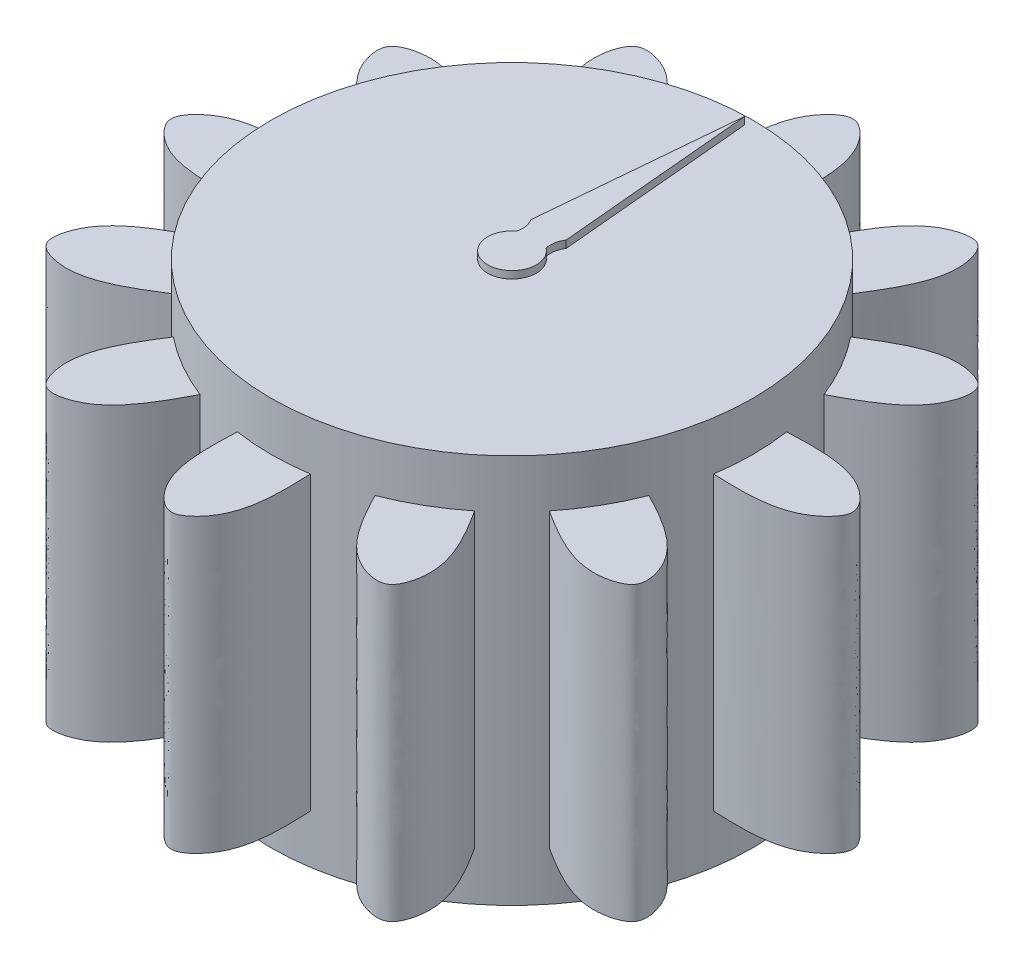
from build123d import *

# Parameters (mm, degrees)
SKETCH1_R           = 9.9
BOSS_EXTRUDE1_DEPTH = 12
SKETCH2_R           = 9.9
BOSS_EXTRUDE2_DEPTH = 2
BOSS_EXTRUDE3_DEPTH = 0.3
BOSS_EXTRUDE5_DEPTH = 12
CIRPATTERN1_COUNT   = 12
BOSS_EXTRUDE6_START = 2
SKETCH5_R           = 9.9
BOSS_EXTRUDE6_DEPTH = 2
BOSS_EXTRUDE7_START = 0.3
BOSS_EXTRUDE7_DEPTH = 0.3


with BuildPart() as part:
    # Sketch1 → Boss-Extrude1 (new body)
    with BuildSketch(Plane(origin=(0, 0, 0), x_dir=(1, 0, 0), z_dir=(0, 1, 0))):
        with Locations(Location((0, 0, 0), (0, 0, 270))):
            Circle(SKETCH1_R)
    extrude(amount=BOSS_EXTRUDE1_DEPTH)

    # Sketch2 → Boss-Extrude2 (add)
    with BuildSketch(Plane(origin=(0, 12, 0), x_dir=(1, 0, 0), z_dir=(0, 1, 0))):
        with Locations(Location((0, 0, 0), (0, 0, 270))):
            Circle(SKETCH2_R)
    extrude(amount=BOSS_EXTRUDE2_DEPTH)

    # Sketch3 → Boss-Extrude3 (add)
    with BuildSketch(Plane(origin=(0, 14, 0), x_dir=(1, 0, 0), z_dir=(0, 1, 0))):
        with BuildLine():
            Line((0, 9.561873975), (0.727858815, 1.5))
            ThreePointArc((0.727858815, 1.5), (0.597494474, 1.162134703), (0.6, 0.8))
            ThreePointArc((0.6, 0.8), (0, -1), (-0.6, 0.8))
            ThreePointArc((-0.6, 0.8), (-0.592381481, 1.161228328), (-0.71735976, 1.500233309))
            Line((-0.71735976, 1.500233309), (0, 9.561873975))
        make_face()
    extrude(amount=BOSS_EXTRUDE3_DEPTH)

    # Sketch4 → Boss-Extrude5 (add)
    with BuildSketch(Plane.XZ):
        with BuildLine():
            Line((-1.5, -9.785703858), (1.5, -9.785703858))
            add(Edge.make_bspline(
                [(1.5, -9.785703858), (1.52233311, -10.350909106), (1.574363817, -11.667699624), (1.199302648, -13.281179815), (0, -14.188968688), (-1.199302648, -13.281179815), (-1.574363817, -11.667699624), (-1.52233311, -10.350909106), (-1.5, -9.785703858)],
                knots=[0, 0, 0, 0, 0.178316257, 0.415433434, 0.5, 0.584566566, 0.821683743, 1, 1, 1, 1], degree=3))
        make_face()
    boss_extrude5 = extrude(amount=-BOSS_EXTRUDE5_DEPTH)

    # CirPattern1: Boss-Extrude5 ×12 about axis
    cirpattern1_axis = Axis((0, 0, 0), (0, 1, 0))
    for i in range(1, CIRPATTERN1_COUNT):
        add(boss_extrude5.rotate(cirpattern1_axis, i * 360 / CIRPATTERN1_COUNT))

    # Sketch5 → Boss-Extrude6 (add)
    with BuildSketch(Plane.XZ.offset(BOSS_EXTRUDE6_START)):
        with Locations(Location((0, 0, 0), (0, 0, 270))):
            Circle(SKETCH5_R)
    extrude(amount=-BOSS_EXTRUDE6_DEPTH)

    # Sketch6 → Boss-Extrude7 (add)
    with BuildSketch(Plane.XZ.offset(2).offset(BOSS_EXTRUDE7_START)):
        with BuildLine():
            Line((0, -9.561873975), (0.727858815, -1.5))
            ThreePointArc((0.727858815, -1.5), (0.597494474, -1.162134703), (0.6, -0.8))
            ThreePointArc((0.6, -0.8), (0, 1), (-0.6, -0.8))
            ThreePointArc((-0.6, -0.8), (-0.592381481, -1.161228328), (-0.71735976, -1.500233309))
            Line((-0.71735976, -1.500233309), (0, -9.561873975))
        make_face()
    extrude(amount=-BOSS_EXTRUDE7_DEPTH)


solid = part.part
